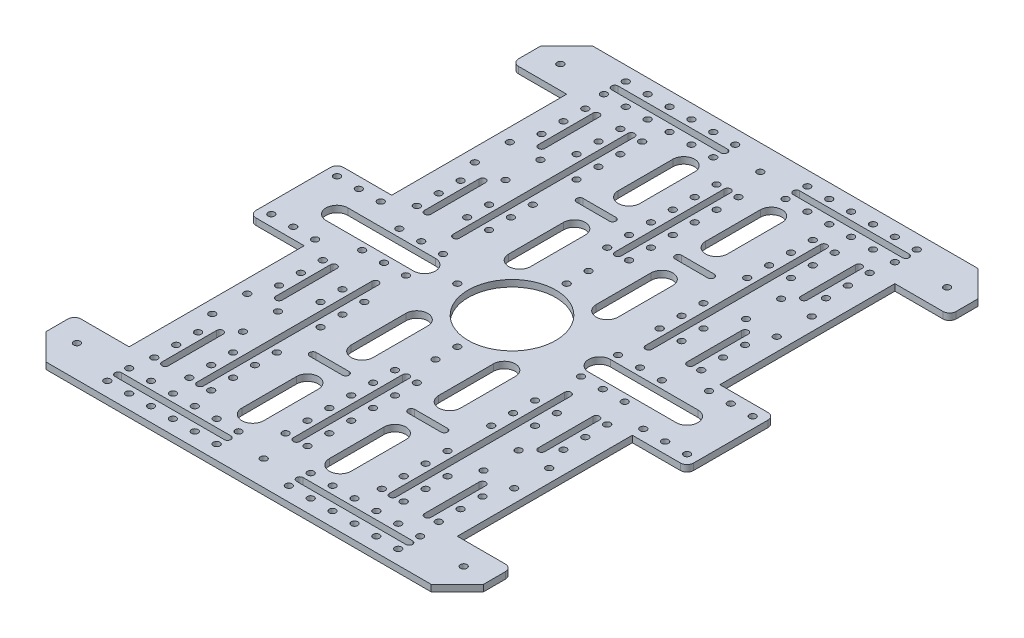
from build123d import *

# Parameters (mm, degrees)
SKETCH1_R           = 1.5
SKETCH1_R_2         = 20
BOSS_EXTRUDE1_DEPTH = 3


with BuildPart() as part:
    # Sketch1 → Boss-Extrude1 (new body)
    with BuildSketch(Plane(origin=(0, 0, 0), x_dir=(1, 0, 0), z_dir=(0, 1, 0))):
        with BuildLine():
            Line((-100, 113), (-88, 125))
            Line((-88, 125), (88, 125))
            Line((88, 125), (100, 113))
            Line((100, 113), (100, 103))
            ThreePointArc((100, 103), (99.121320344, 100.878679656), (97, 100))
            Line((97, 100), (75, 100))
            Line((75, 100), (75, 20))
            Line((75, 20), (97, 20))
            ThreePointArc((97, 20), (99.121320344, 19.121320344), (100, 17))
            Line((100, 17), (100, -17))
            ThreePointArc((100, -17), (99.121320344, -19.121320344), (97, -20))
            Line((97, -20), (75, -20))
            Line((75, -20), (75, -100))
            Line((75, -100), (97, -100))
            ThreePointArc((97, -100), (99.121320344, -100.878679656), (100, -103))
            Line((100, -103), (100, -113))
            Line((100, -113), (88, -125))
            Line((88, -125), (-88, -125))
            Line((-88, -125), (-100, -113))
            Line((-100, -113), (-100, -103))
            ThreePointArc((-100, -103), (-99.121320344, -100.878679656), (-97, -100))
            Line((-97, -100), (-75, -100))
            Line((-75, -100), (-75, -20))
            Line((-75, -20), (-97, -20))
            ThreePointArc((-97, -20), (-99.121320344, -19.121320344), (-100, -17))
            Line((-100, -17), (-100, 17))
            ThreePointArc((-100, 17), (-99.121320344, 19.121320344), (-97, 20))
            Line((-97, 20), (-75, 20))
            Line((-75, 20), (-75, 100))
            Line((-75, 100), (-97, 100))
            ThreePointArc((-97, 100), (-99.121320344, 100.878679656), (-100, 103))
            Line((-100, 103), (-100, 113))
        make_face()
        with Locations(Location((0, 113.5, 0), (0, 0, 270))):
            Circle(SKETCH1_R, mode=Mode.SUBTRACT)
        with Locations(Location((0, 0, 0), (0, 0, 270))):
            Circle(SKETCH1_R_2, mode=Mode.SUBTRACT)
        with Locations(Location((-69, 68, 0), (0, 0, 270))):
            Circle(SKETCH1_R, mode=Mode.SUBTRACT)
        with Locations(Location((-69, 52, 0), (0, 0, 270))):
            Circle(SKETCH1_R, mode=Mode.SUBTRACT)
        with Locations(Location((-55, 68, 0), (0, 0, 270))):
            Circle(SKETCH1_R, mode=Mode.SUBTRACT)
        with Locations(Location((-55, 52, 0), (0, 0, 270))):
            Circle(SKETCH1_R, mode=Mode.SUBTRACT)
        with Locations(Location((-88.381273056, 110.47659132, 0), (0, 0, 270))):
            Circle(SKETCH1_R, mode=Mode.SUBTRACT)
        with Locations(Location((-49, 98.5, 0), (0, 0, 270))):
            Circle(SKETCH1_R, mode=Mode.SUBTRACT)
        with Locations(Location((-49, 88.5, 0), (0, 0, 270))):
            Circle(SKETCH1_R, mode=Mode.SUBTRACT)
        with Locations(Location((-49, 78.5, 0), (0, 0, 270))):
            Circle(SKETCH1_R, mode=Mode.SUBTRACT)
        with Locations(Location((-49, 38.5, 0), (0, 0, 270))):
            Circle(SKETCH1_R, mode=Mode.SUBTRACT)
        with Locations(Location((-49, 28.5, 0), (0, 0, 270))):
            Circle(SKETCH1_R, mode=Mode.SUBTRACT)
        with Locations(Location((-39, 88.5, 0), (0, 0, 270))):
            Circle(SKETCH1_R, mode=Mode.SUBTRACT)
        with Locations(Location((-39, 78.5, 0), (0, 0, 270))):
            Circle(SKETCH1_R, mode=Mode.SUBTRACT)
        with Locations(Location((-39, 68.5, 0), (0, 0, 270))):
            Circle(SKETCH1_R, mode=Mode.SUBTRACT)
        with Locations(Location((-39, 48.5, 0), (0, 0, 270))):
            Circle(SKETCH1_R, mode=Mode.SUBTRACT)
        with Locations(Location((-39, 38.5, 0), (0, 0, 270))):
            Circle(SKETCH1_R, mode=Mode.SUBTRACT)
        with Locations(Location((-39, 28.5, 0), (0, 0, 270))):
            Circle(SKETCH1_R, mode=Mode.SUBTRACT)
        with Locations(Location((-39, 98.5, 0), (0, 0, 270))):
            Circle(SKETCH1_R, mode=Mode.SUBTRACT)
        with Locations(Location((-66.5, 108.5, 0), (0, 0, 270))):
            Circle(SKETCH1_R, mode=Mode.SUBTRACT)
        with Locations(Location((-56.5, 108.5, 0), (0, 0, 270))):
            Circle(SKETCH1_R, mode=Mode.SUBTRACT)
        with Locations(Location((-46.5, 108.5, 0), (0, 0, 270))):
            Circle(SKETCH1_R, mode=Mode.SUBTRACT)
        with Locations(Location((-36.5, 108.5, 0), (0, 0, 270))):
            Circle(SKETCH1_R, mode=Mode.SUBTRACT)
        with Locations(Location((-26.5, 108.5, 0), (0, 0, 270))):
            Circle(SKETCH1_R, mode=Mode.SUBTRACT)
        with Locations(Location((-16.5, 108.5, 0), (0, 0, 270))):
            Circle(SKETCH1_R, mode=Mode.SUBTRACT)
        with Locations(Location((-56.5, 118.5, 0), (0, 0, 270))):
            Circle(SKETCH1_R, mode=Mode.SUBTRACT)
        with Locations(Location((-46.5, 118.5, 0), (0, 0, 270))):
            Circle(SKETCH1_R, mode=Mode.SUBTRACT)
        with Locations(Location((-36.5, 118.5, 0), (0, 0, 270))):
            Circle(SKETCH1_R, mode=Mode.SUBTRACT)
        with Locations(Location((-26.5, 118.5, 0), (0, 0, 270))):
            Circle(SKETCH1_R, mode=Mode.SUBTRACT)
        with Locations(Location((-16.5, 118.5, 0), (0, 0, 270))):
            Circle(SKETCH1_R, mode=Mode.SUBTRACT)
        with Locations(Location((-66.5, 118.5, 0), (0, 0, 270))):
            Circle(SKETCH1_R, mode=Mode.SUBTRACT)
        with Locations(Location((-5, 98.5, 0), (0, 0, 270))):
            Circle(SKETCH1_R, mode=Mode.SUBTRACT)
        with Locations(Location((-5, 88.5, 0), (0, 0, 270))):
            Circle(SKETCH1_R, mode=Mode.SUBTRACT)
        with Locations(Location((-5, 78.5, 0), (0, 0, 270))):
            Circle(SKETCH1_R, mode=Mode.SUBTRACT)
        with Locations(Location((-5, 68.5, 0), (0, 0, 270))):
            Circle(SKETCH1_R, mode=Mode.SUBTRACT)
        with Locations(Location((-5, 58.5, 0), (0, 0, 270))):
            Circle(SKETCH1_R, mode=Mode.SUBTRACT)
        with Locations(Location((-5, 48.5, 0), (0, 0, 270))):
            Circle(SKETCH1_R, mode=Mode.SUBTRACT)
        with Locations(Location((-95, 15, 0), (0, 0, 270))):
            Circle(SKETCH1_R, mode=Mode.SUBTRACT)
        with Locations(Location((-85, 15, 0), (0, 0, 270))):
            Circle(SKETCH1_R, mode=Mode.SUBTRACT)
        with Locations(Location((-75, 15, 0), (0, 0, 270))):
            Circle(SKETCH1_R, mode=Mode.SUBTRACT)
        with Locations(Location((-65, 98.5, 0), (0, 0, 270))):
            Circle(SKETCH1_R, mode=Mode.SUBTRACT)
        with Locations(Location((-65, 88.5, 0), (0, 0, 270))):
            Circle(SKETCH1_R, mode=Mode.SUBTRACT)
        with Locations(Location((-65, 78.5, 0), (0, 0, 270))):
            Circle(SKETCH1_R, mode=Mode.SUBTRACT)
        with Locations(Location((-65, 21.5, 0), (0, 0, 270))):
            Circle(SKETCH1_R, mode=Mode.SUBTRACT)
        with Locations(Location((-65, 31.5, 0), (0, 0, 270))):
            Circle(SKETCH1_R, mode=Mode.SUBTRACT)
        with Locations(Location((-65, 41.5, 0), (0, 0, 270))):
            Circle(SKETCH1_R, mode=Mode.SUBTRACT)
        with Locations(Location((-60, 8.5, 0), (0, 0, 270))):
            Circle(SKETCH1_R, mode=Mode.SUBTRACT)
        with Locations(Location((-50, 8.5, 0), (0, 0, 270))):
            Circle(SKETCH1_R, mode=Mode.SUBTRACT)
        with Locations(Location((-40, 8.5, 0), (0, 0, 270))):
            Circle(SKETCH1_R, mode=Mode.SUBTRACT)
        with Locations(Location((-40, -8.5, 0), (0, 0, 270))):
            Circle(SKETCH1_R, mode=Mode.SUBTRACT)
        with Locations(Location((-50, -8.5, 0), (0, 0, 270))):
            Circle(SKETCH1_R, mode=Mode.SUBTRACT)
        with Locations(Location((-60, -8.5, 0), (0, 0, 270))):
            Circle(SKETCH1_R, mode=Mode.SUBTRACT)
        with Locations(Location((-65, -41.5, 0), (0, 0, 270))):
            Circle(SKETCH1_R, mode=Mode.SUBTRACT)
        with Locations(Location((-65, -31.5, 0), (0, 0, 270))):
            Circle(SKETCH1_R, mode=Mode.SUBTRACT)
        with Locations(Location((-65, -21.5, 0), (0, 0, 270))):
            Circle(SKETCH1_R, mode=Mode.SUBTRACT)
        with Locations(Location((-65, -78.5, 0), (0, 0, 270))):
            Circle(SKETCH1_R, mode=Mode.SUBTRACT)
        with Locations(Location((-65, -88.5, 0), (0, 0, 270))):
            Circle(SKETCH1_R, mode=Mode.SUBTRACT)
        with Locations(Location((-65, -98.5, 0), (0, 0, 270))):
            Circle(SKETCH1_R, mode=Mode.SUBTRACT)
        with Locations(Location((-75, -15, 0), (0, 0, 270))):
            Circle(SKETCH1_R, mode=Mode.SUBTRACT)
        with Locations(Location((-85, -15, 0), (0, 0, 270))):
            Circle(SKETCH1_R, mode=Mode.SUBTRACT)
        with Locations(Location((-95, -15, 0), (0, 0, 270))):
            Circle(SKETCH1_R, mode=Mode.SUBTRACT)
        with Locations(Location((-5, -48.5, 0), (0, 0, 270))):
            Circle(SKETCH1_R, mode=Mode.SUBTRACT)
        with Locations(Location((-5, -58.5, 0), (0, 0, 270))):
            Circle(SKETCH1_R, mode=Mode.SUBTRACT)
        with Locations(Location((-5, -68.5, 0), (0, 0, 270))):
            Circle(SKETCH1_R, mode=Mode.SUBTRACT)
        with Locations(Location((-5, -78.5, 0), (0, 0, 270))):
            Circle(SKETCH1_R, mode=Mode.SUBTRACT)
        with Locations(Location((-5, -88.5, 0), (0, 0, 270))):
            Circle(SKETCH1_R, mode=Mode.SUBTRACT)
        with Locations(Location((-5, -98.5, 0), (0, 0, 270))):
            Circle(SKETCH1_R, mode=Mode.SUBTRACT)
        with Locations(Location((-66.5, -118.5, 0), (0, 0, 270))):
            Circle(SKETCH1_R, mode=Mode.SUBTRACT)
        with Locations(Location((-16.5, -118.5, 0), (0, 0, 270))):
            Circle(SKETCH1_R, mode=Mode.SUBTRACT)
        with Locations(Location((-26.5, -118.5, 0), (0, 0, 270))):
            Circle(SKETCH1_R, mode=Mode.SUBTRACT)
        with Locations(Location((-36.5, -118.5, 0), (0, 0, 270))):
            Circle(SKETCH1_R, mode=Mode.SUBTRACT)
        with Locations(Location((-46.5, -118.5, 0), (0, 0, 270))):
            Circle(SKETCH1_R, mode=Mode.SUBTRACT)
        with Locations(Location((-56.5, -118.5, 0), (0, 0, 270))):
            Circle(SKETCH1_R, mode=Mode.SUBTRACT)
        with Locations(Location((-16.5, -108.5, 0), (0, 0, 270))):
            Circle(SKETCH1_R, mode=Mode.SUBTRACT)
        with Locations(Location((-26.5, -108.5, 0), (0, 0, 270))):
            Circle(SKETCH1_R, mode=Mode.SUBTRACT)
        with Locations(Location((-36.5, -108.5, 0), (0, 0, 270))):
            Circle(SKETCH1_R, mode=Mode.SUBTRACT)
        with Locations(Location((-46.5, -108.5, 0), (0, 0, 270))):
            Circle(SKETCH1_R, mode=Mode.SUBTRACT)
        with Locations(Location((-56.5, -108.5, 0), (0, 0, 270))):
            Circle(SKETCH1_R, mode=Mode.SUBTRACT)
        with Locations(Location((-66.5, -108.5, 0), (0, 0, 270))):
            Circle(SKETCH1_R, mode=Mode.SUBTRACT)
        with Locations(Location((-39, -98.5, 0), (0, 0, 270))):
            Circle(SKETCH1_R, mode=Mode.SUBTRACT)
        with Locations(Location((-39, -28.5, 0), (0, 0, 270))):
            Circle(SKETCH1_R, mode=Mode.SUBTRACT)
        with Locations(Location((-39, -38.5, 0), (0, 0, 270))):
            Circle(SKETCH1_R, mode=Mode.SUBTRACT)
        with Locations(Location((-39, -48.5, 0), (0, 0, 270))):
            Circle(SKETCH1_R, mode=Mode.SUBTRACT)
        with Locations(Location((-39, -68.5, 0), (0, 0, 270))):
            Circle(SKETCH1_R, mode=Mode.SUBTRACT)
        with Locations(Location((-39, -78.5, 0), (0, 0, 270))):
            Circle(SKETCH1_R, mode=Mode.SUBTRACT)
        with Locations(Location((-39, -88.5, 0), (0, 0, 270))):
            Circle(SKETCH1_R, mode=Mode.SUBTRACT)
        with Locations(Location((-49, -28.5, 0), (0, 0, 270))):
            Circle(SKETCH1_R, mode=Mode.SUBTRACT)
        with Locations(Location((-49, -38.5, 0), (0, 0, 270))):
            Circle(SKETCH1_R, mode=Mode.SUBTRACT)
        with Locations(Location((-49, -78.5, 0), (0, 0, 270))):
            Circle(SKETCH1_R, mode=Mode.SUBTRACT)
        with Locations(Location((-49, -88.5, 0), (0, 0, 270))):
            Circle(SKETCH1_R, mode=Mode.SUBTRACT)
        with Locations(Location((-49, -98.5, 0), (0, 0, 270))):
            Circle(SKETCH1_R, mode=Mode.SUBTRACT)
        with Locations(Location((-88.381273056, -110.47659132, 0), (0, 0, 270))):
            Circle(SKETCH1_R, mode=Mode.SUBTRACT)
        with Locations(Location((-55, -52, 0), (0, 0, 270))):
            Circle(SKETCH1_R, mode=Mode.SUBTRACT)
        with Locations(Location((-55, -68, 0), (0, 0, 270))):
            Circle(SKETCH1_R, mode=Mode.SUBTRACT)
        with Locations(Location((-69, -52, 0), (0, 0, 270))):
            Circle(SKETCH1_R, mode=Mode.SUBTRACT)
        with Locations(Location((-69, -68, 0), (0, 0, 270))):
            Circle(SKETCH1_R, mode=Mode.SUBTRACT)
        with Locations(Location((0, -113.5, 0), (0, 0, 270))):
            Circle(SKETCH1_R, mode=Mode.SUBTRACT)
        with Locations(Location((69, -68, 0), (0, 0, 270))):
            Circle(SKETCH1_R, mode=Mode.SUBTRACT)
        with Locations(Location((69, -52, 0), (0, 0, 270))):
            Circle(SKETCH1_R, mode=Mode.SUBTRACT)
        with Locations(Location((55, -68, 0), (0, 0, 270))):
            Circle(SKETCH1_R, mode=Mode.SUBTRACT)
        with Locations(Location((55, -52, 0), (0, 0, 270))):
            Circle(SKETCH1_R, mode=Mode.SUBTRACT)
        with Locations(Location((88.381273056, -110.47659132, 0), (0, 0, 270))):
            Circle(SKETCH1_R, mode=Mode.SUBTRACT)
        with Locations(Location((49, -98.5, 0), (0, 0, 270))):
            Circle(SKETCH1_R, mode=Mode.SUBTRACT)
        with Locations(Location((49, -88.5, 0), (0, 0, 270))):
            Circle(SKETCH1_R, mode=Mode.SUBTRACT)
        with Locations(Location((49, -78.5, 0), (0, 0, 270))):
            Circle(SKETCH1_R, mode=Mode.SUBTRACT)
        with Locations(Location((49, -38.5, 0), (0, 0, 270))):
            Circle(SKETCH1_R, mode=Mode.SUBTRACT)
        with Locations(Location((49, -28.5, 0), (0, 0, 270))):
            Circle(SKETCH1_R, mode=Mode.SUBTRACT)
        with Locations(Location((39, -88.5, 0), (0, 0, 270))):
            Circle(SKETCH1_R, mode=Mode.SUBTRACT)
        with Locations(Location((39, -78.5, 0), (0, 0, 270))):
            Circle(SKETCH1_R, mode=Mode.SUBTRACT)
        with Locations(Location((39, -68.5, 0), (0, 0, 270))):
            Circle(SKETCH1_R, mode=Mode.SUBTRACT)
        with Locations(Location((39, -48.5, 0), (0, 0, 270))):
            Circle(SKETCH1_R, mode=Mode.SUBTRACT)
        with Locations(Location((39, -38.5, 0), (0, 0, 270))):
            Circle(SKETCH1_R, mode=Mode.SUBTRACT)
        with Locations(Location((39, -28.5, 0), (0, 0, 270))):
            Circle(SKETCH1_R, mode=Mode.SUBTRACT)
        with Locations(Location((39, -98.5, 0), (0, 0, 270))):
            Circle(SKETCH1_R, mode=Mode.SUBTRACT)
        with Locations(Location((66.5, -108.5, 0), (0, 0, 270))):
            Circle(SKETCH1_R, mode=Mode.SUBTRACT)
        with Locations(Location((56.5, -108.5, 0), (0, 0, 270))):
            Circle(SKETCH1_R, mode=Mode.SUBTRACT)
        with Locations(Location((46.5, -108.5, 0), (0, 0, 270))):
            Circle(SKETCH1_R, mode=Mode.SUBTRACT)
        with Locations(Location((36.5, -108.5, 0), (0, 0, 270))):
            Circle(SKETCH1_R, mode=Mode.SUBTRACT)
        with Locations(Location((26.5, -108.5, 0), (0, 0, 270))):
            Circle(SKETCH1_R, mode=Mode.SUBTRACT)
        with Locations(Location((16.5, -108.5, 0), (0, 0, 270))):
            Circle(SKETCH1_R, mode=Mode.SUBTRACT)
        with Locations(Location((56.5, -118.5, 0), (0, 0, 270))):
            Circle(SKETCH1_R, mode=Mode.SUBTRACT)
        with Locations(Location((46.5, -118.5, 0), (0, 0, 270))):
            Circle(SKETCH1_R, mode=Mode.SUBTRACT)
        with Locations(Location((36.5, -118.5, 0), (0, 0, 270))):
            Circle(SKETCH1_R, mode=Mode.SUBTRACT)
        with Locations(Location((26.5, -118.5, 0), (0, 0, 270))):
            Circle(SKETCH1_R, mode=Mode.SUBTRACT)
        with Locations(Location((16.5, -118.5, 0), (0, 0, 270))):
            Circle(SKETCH1_R, mode=Mode.SUBTRACT)
        with Locations(Location((66.5, -118.5, 0), (0, 0, 270))):
            Circle(SKETCH1_R, mode=Mode.SUBTRACT)
        with Locations(Location((5, -98.5, 0), (0, 0, 270))):
            Circle(SKETCH1_R, mode=Mode.SUBTRACT)
        with Locations(Location((5, -88.5, 0), (0, 0, 270))):
            Circle(SKETCH1_R, mode=Mode.SUBTRACT)
        with Locations(Location((5, -78.5, 0), (0, 0, 270))):
            Circle(SKETCH1_R, mode=Mode.SUBTRACT)
        with Locations(Location((5, -68.5, 0), (0, 0, 270))):
            Circle(SKETCH1_R, mode=Mode.SUBTRACT)
        with Locations(Location((5, -58.5, 0), (0, 0, 270))):
            Circle(SKETCH1_R, mode=Mode.SUBTRACT)
        with Locations(Location((5, -48.5, 0), (0, 0, 270))):
            Circle(SKETCH1_R, mode=Mode.SUBTRACT)
        with Locations(Location((95, -15, 0), (0, 0, 270))):
            Circle(SKETCH1_R, mode=Mode.SUBTRACT)
        with Locations(Location((85, -15, 0), (0, 0, 270))):
            Circle(SKETCH1_R, mode=Mode.SUBTRACT)
        with Locations(Location((75, -15, 0), (0, 0, 270))):
            Circle(SKETCH1_R, mode=Mode.SUBTRACT)
        with Locations(Location((65, -98.5, 0), (0, 0, 270))):
            Circle(SKETCH1_R, mode=Mode.SUBTRACT)
        with Locations(Location((65, -88.5, 0), (0, 0, 270))):
            Circle(SKETCH1_R, mode=Mode.SUBTRACT)
        with Locations(Location((65, -78.5, 0), (0, 0, 270))):
            Circle(SKETCH1_R, mode=Mode.SUBTRACT)
        with Locations(Location((65, -21.5, 0), (0, 0, 270))):
            Circle(SKETCH1_R, mode=Mode.SUBTRACT)
        with Locations(Location((65, -31.5, 0), (0, 0, 270))):
            Circle(SKETCH1_R, mode=Mode.SUBTRACT)
        with Locations(Location((65, -41.5, 0), (0, 0, 270))):
            Circle(SKETCH1_R, mode=Mode.SUBTRACT)
        with Locations(Location((60, -8.5, 0), (0, 0, 270))):
            Circle(SKETCH1_R, mode=Mode.SUBTRACT)
        with Locations(Location((50, -8.5, 0), (0, 0, 270))):
            Circle(SKETCH1_R, mode=Mode.SUBTRACT)
        with Locations(Location((40, -8.5, 0), (0, 0, 270))):
            Circle(SKETCH1_R, mode=Mode.SUBTRACT)
        with Locations(Location((40, 8.5, 0), (0, 0, 270))):
            Circle(SKETCH1_R, mode=Mode.SUBTRACT)
        with Locations(Location((50, 8.5, 0), (0, 0, 270))):
            Circle(SKETCH1_R, mode=Mode.SUBTRACT)
        with Locations(Location((60, 8.5, 0), (0, 0, 270))):
            Circle(SKETCH1_R, mode=Mode.SUBTRACT)
        with Locations(Location((65, 41.5, 0), (0, 0, 270))):
            Circle(SKETCH1_R, mode=Mode.SUBTRACT)
        with Locations(Location((65, 31.5, 0), (0, 0, 270))):
            Circle(SKETCH1_R, mode=Mode.SUBTRACT)
        with Locations(Location((65, 21.5, 0), (0, 0, 270))):
            Circle(SKETCH1_R, mode=Mode.SUBTRACT)
        with Locations(Location((65, 78.5, 0), (0, 0, 270))):
            Circle(SKETCH1_R, mode=Mode.SUBTRACT)
        with Locations(Location((65, 88.5, 0), (0, 0, 270))):
            Circle(SKETCH1_R, mode=Mode.SUBTRACT)
        with Locations(Location((65, 98.5, 0), (0, 0, 270))):
            Circle(SKETCH1_R, mode=Mode.SUBTRACT)
        with Locations(Location((75, 15, 0), (0, 0, 270))):
            Circle(SKETCH1_R, mode=Mode.SUBTRACT)
        with Locations(Location((85, 15, 0), (0, 0, 270))):
            Circle(SKETCH1_R, mode=Mode.SUBTRACT)
        with Locations(Location((95, 15, 0), (0, 0, 270))):
            Circle(SKETCH1_R, mode=Mode.SUBTRACT)
        with Locations(Location((5, 48.5, 0), (0, 0, 270))):
            Circle(SKETCH1_R, mode=Mode.SUBTRACT)
        with Locations(Location((5, 58.5, 0), (0, 0, 270))):
            Circle(SKETCH1_R, mode=Mode.SUBTRACT)
        with Locations(Location((5, 68.5, 0), (0, 0, 270))):
            Circle(SKETCH1_R, mode=Mode.SUBTRACT)
        with Locations(Location((5, 78.5, 0), (0, 0, 270))):
            Circle(SKETCH1_R, mode=Mode.SUBTRACT)
        with Locations(Location((5, 88.5, 0), (0, 0, 270))):
            Circle(SKETCH1_R, mode=Mode.SUBTRACT)
        with Locations(Location((5, 98.5, 0), (0, 0, 270))):
            Circle(SKETCH1_R, mode=Mode.SUBTRACT)
        with Locations(Location((66.5, 118.5, 0), (0, 0, 270))):
            Circle(SKETCH1_R, mode=Mode.SUBTRACT)
        with Locations(Location((16.5, 118.5, 0), (0, 0, 270))):
            Circle(SKETCH1_R, mode=Mode.SUBTRACT)
        with Locations(Location((26.5, 118.5, 0), (0, 0, 270))):
            Circle(SKETCH1_R, mode=Mode.SUBTRACT)
        with Locations(Location((36.5, 118.5, 0), (0, 0, 270))):
            Circle(SKETCH1_R, mode=Mode.SUBTRACT)
        with Locations(Location((46.5, 118.5, 0), (0, 0, 270))):
            Circle(SKETCH1_R, mode=Mode.SUBTRACT)
        with Locations(Location((56.5, 118.5, 0), (0, 0, 270))):
            Circle(SKETCH1_R, mode=Mode.SUBTRACT)
        with Locations(Location((16.5, 108.5, 0), (0, 0, 270))):
            Circle(SKETCH1_R, mode=Mode.SUBTRACT)
        with Locations(Location((26.5, 108.5, 0), (0, 0, 270))):
            Circle(SKETCH1_R, mode=Mode.SUBTRACT)
        with Locations(Location((36.5, 108.5, 0), (0, 0, 270))):
            Circle(SKETCH1_R, mode=Mode.SUBTRACT)
        with Locations(Location((46.5, 108.5, 0), (0, 0, 270))):
            Circle(SKETCH1_R, mode=Mode.SUBTRACT)
        with Locations(Location((56.5, 108.5, 0), (0, 0, 270))):
            Circle(SKETCH1_R, mode=Mode.SUBTRACT)
        with Locations(Location((66.5, 108.5, 0), (0, 0, 270))):
            Circle(SKETCH1_R, mode=Mode.SUBTRACT)
        with Locations(Location((39, 98.5, 0), (0, 0, 270))):
            Circle(SKETCH1_R, mode=Mode.SUBTRACT)
        with Locations(Location((39, 28.5, 0), (0, 0, 270))):
            Circle(SKETCH1_R, mode=Mode.SUBTRACT)
        with Locations(Location((39, 38.5, 0), (0, 0, 270))):
            Circle(SKETCH1_R, mode=Mode.SUBTRACT)
        with Locations(Location((39, 48.5, 0), (0, 0, 270))):
            Circle(SKETCH1_R, mode=Mode.SUBTRACT)
        with Locations(Location((39, 68.5, 0), (0, 0, 270))):
            Circle(SKETCH1_R, mode=Mode.SUBTRACT)
        with Locations(Location((39, 78.5, 0), (0, 0, 270))):
            Circle(SKETCH1_R, mode=Mode.SUBTRACT)
        with Locations(Location((39, 88.5, 0), (0, 0, 270))):
            Circle(SKETCH1_R, mode=Mode.SUBTRACT)
        with Locations(Location((49, 28.5, 0), (0, 0, 270))):
            Circle(SKETCH1_R, mode=Mode.SUBTRACT)
        with Locations(Location((49, 38.5, 0), (0, 0, 270))):
            Circle(SKETCH1_R, mode=Mode.SUBTRACT)
        with Locations(Location((49, 78.5, 0), (0, 0, 270))):
            Circle(SKETCH1_R, mode=Mode.SUBTRACT)
        with Locations(Location((49, 88.5, 0), (0, 0, 270))):
            Circle(SKETCH1_R, mode=Mode.SUBTRACT)
        with Locations(Location((49, 98.5, 0), (0, 0, 270))):
            Circle(SKETCH1_R, mode=Mode.SUBTRACT)
        with Locations(Location((88.381273056, 110.47659132, 0), (0, 0, 270))):
            Circle(SKETCH1_R, mode=Mode.SUBTRACT)
        with Locations(Location((55, 52, 0), (0, 0, 270))):
            Circle(SKETCH1_R, mode=Mode.SUBTRACT)
        with Locations(Location((55, 68, 0), (0, 0, 270))):
            Circle(SKETCH1_R, mode=Mode.SUBTRACT)
        with Locations(Location((69, 52, 0), (0, 0, 270))):
            Circle(SKETCH1_R, mode=Mode.SUBTRACT)
        with Locations(Location((69, 68, 0), (0, 0, 270))):
            Circle(SKETCH1_R, mode=Mode.SUBTRACT)
        with Locations(Location((0, 25, 0), (0, 0, 270))):
            Circle(SKETCH1_R, mode=Mode.SUBTRACT)
        with Locations(Location((0, 35, 0), (0, 0, 270))):
            Circle(SKETCH1_R, mode=Mode.SUBTRACT)
        with Locations(Location((0, -35, 0), (0, 0, 270))):
            Circle(SKETCH1_R, mode=Mode.SUBTRACT)
        with Locations(Location((0, -25, 0), (0, 0, 270))):
            Circle(SKETCH1_R, mode=Mode.SUBTRACT)
        with Locations(Location((-25, 0, 0), (0, 0, 270))):
            Circle(SKETCH1_R, mode=Mode.SUBTRACT)
        with BuildLine():
            Line((-66.5, 115), (-16.5, 115))
            ThreePointArc((-16.5, 115), (-15, 113.5), (-16.5, 112))
            Line((-16.5, 112), (-66.5, 112))
            ThreePointArc((-66.5, 112), (-68, 113.5), (-66.5, 115))
        make_face(mode=Mode.SUBTRACT)
        with BuildLine():
            Line((1.5, 98.5), (1.5, 48.5))
            ThreePointArc((1.5, 48.5), (0, 47), (-1.5, 48.5))
            Line((-1.5, 48.5), (-1.5, 98.5))
            ThreePointArc((-1.5, 98.5), (0, 100), (1.5, 98.5))
        make_face(mode=Mode.SUBTRACT)
        with BuildLine():
            Line((-42.5, 98.5), (-42.5, 18.5))
            ThreePointArc((-42.5, 18.5), (-44, 17), (-45.5, 18.5))
            Line((-45.5, 18.5), (-45.5, 98.5))
            ThreePointArc((-45.5, 98.5), (-44, 100), (-42.5, 98.5))
        make_face(mode=Mode.SUBTRACT)
        with BuildLine():
            Line((-15, 98.5), (-15, 73.5))
            ThreePointArc((-15, 73.5), (-20, 68.5), (-25, 73.5))
            Line((-25, 73.5), (-25, 98.5))
            ThreePointArc((-25, 98.5), (-20, 103.5), (-15, 98.5))
        make_face(mode=Mode.SUBTRACT)
        with BuildLine():
            Line((-15, 48.5), (-15, 23.5))
            ThreePointArc((-15, 23.5), (-20, 18.5), (-25, 23.5))
            Line((-25, 23.5), (-25, 48.5))
            ThreePointArc((-25, 48.5), (-20, 53.5), (-15, 48.5))
        make_face(mode=Mode.SUBTRACT)
        with BuildLine():
            Line((-80, 5), (-40, 5))
            ThreePointArc((-40, 5), (-35, 0), (-40, -5))
            Line((-40, -5), (-80, -5))
            ThreePointArc((-80, -5), (-85, 0), (-80, 5))
        make_face(mode=Mode.SUBTRACT)
        with BuildLine():
            Line((-30, 62.5), (-15, 62.5))
            ThreePointArc((-15, 62.5), (-13.5, 61), (-15, 59.5))
            Line((-15, 59.5), (-30, 59.5))
            ThreePointArc((-30, 59.5), (-31.5, 61), (-30, 62.5))
        make_face(mode=Mode.SUBTRACT)
        with BuildLine():
            Line((-58.5, 98.5), (-58.5, 73.5))
            ThreePointArc((-58.5, 73.5), (-60, 72), (-61.5, 73.5))
            Line((-61.5, 73.5), (-61.5, 98.5))
            ThreePointArc((-61.5, 98.5), (-60, 100), (-58.5, 98.5))
        make_face(mode=Mode.SUBTRACT)
        with BuildLine():
            Line((-58.5, 21.5), (-58.5, 46.5))
            ThreePointArc((-58.5, 46.5), (-60, 48), (-61.5, 46.5))
            Line((-61.5, 46.5), (-61.5, 21.5))
            ThreePointArc((-61.5, 21.5), (-60, 20), (-58.5, 21.5))
        make_face(mode=Mode.SUBTRACT)
        with BuildLine():
            Line((-58.5, -21.5), (-58.5, -46.5))
            ThreePointArc((-58.5, -46.5), (-60, -48), (-61.5, -46.5))
            Line((-61.5, -46.5), (-61.5, -21.5))
            ThreePointArc((-61.5, -21.5), (-60, -20), (-58.5, -21.5))
        make_face(mode=Mode.SUBTRACT)
        with BuildLine():
            Line((-58.5, -98.5), (-58.5, -73.5))
            ThreePointArc((-58.5, -73.5), (-60, -72), (-61.5, -73.5))
            Line((-61.5, -73.5), (-61.5, -98.5))
            ThreePointArc((-61.5, -98.5), (-60, -100), (-58.5, -98.5))
        make_face(mode=Mode.SUBTRACT)
        with BuildLine():
            Line((-30, -62.5), (-15, -62.5))
            ThreePointArc((-15, -62.5), (-13.5, -61), (-15, -59.5))
            Line((-15, -59.5), (-30, -59.5))
            ThreePointArc((-30, -59.5), (-31.5, -61), (-30, -62.5))
        make_face(mode=Mode.SUBTRACT)
        with BuildLine():
            Line((-15, -48.5), (-15, -23.5))
            ThreePointArc((-15, -23.5), (-20, -18.5), (-25, -23.5))
            Line((-25, -23.5), (-25, -48.5))
            ThreePointArc((-25, -48.5), (-20, -53.5), (-15, -48.5))
        make_face(mode=Mode.SUBTRACT)
        with BuildLine():
            Line((-15, -98.5), (-15, -73.5))
            ThreePointArc((-15, -73.5), (-20, -68.5), (-25, -73.5))
            Line((-25, -73.5), (-25, -98.5))
            ThreePointArc((-25, -98.5), (-20, -103.5), (-15, -98.5))
        make_face(mode=Mode.SUBTRACT)
        with BuildLine():
            Line((-42.5, -98.5), (-42.5, -18.5))
            ThreePointArc((-42.5, -18.5), (-44, -17), (-45.5, -18.5))
            Line((-45.5, -18.5), (-45.5, -98.5))
            ThreePointArc((-45.5, -98.5), (-44, -100), (-42.5, -98.5))
        make_face(mode=Mode.SUBTRACT)
        with BuildLine():
            Line((1.5, -98.5), (1.5, -48.5))
            ThreePointArc((1.5, -48.5), (0, -47), (-1.5, -48.5))
            Line((-1.5, -48.5), (-1.5, -98.5))
            ThreePointArc((-1.5, -98.5), (0, -100), (1.5, -98.5))
        make_face(mode=Mode.SUBTRACT)
        with BuildLine():
            Line((-66.5, -115), (-16.5, -115))
            ThreePointArc((-16.5, -115), (-15, -113.5), (-16.5, -112))
            Line((-16.5, -112), (-66.5, -112))
            ThreePointArc((-66.5, -112), (-68, -113.5), (-66.5, -115))
        make_face(mode=Mode.SUBTRACT)
        with BuildLine():
            Line((66.5, -115), (16.5, -115))
            ThreePointArc((16.5, -115), (15, -113.5), (16.5, -112))
            Line((16.5, -112), (66.5, -112))
            ThreePointArc((66.5, -112), (68, -113.5), (66.5, -115))
        make_face(mode=Mode.SUBTRACT)
        with BuildLine():
            Line((42.5, -98.5), (42.5, -18.5))
            ThreePointArc((42.5, -18.5), (44, -17), (45.5, -18.5))
            Line((45.5, -18.5), (45.5, -98.5))
            ThreePointArc((45.5, -98.5), (44, -100), (42.5, -98.5))
        make_face(mode=Mode.SUBTRACT)
        with BuildLine():
            Line((15, -98.5), (15, -73.5))
            ThreePointArc((15, -73.5), (20, -68.5), (25, -73.5))
            Line((25, -73.5), (25, -98.5))
            ThreePointArc((25, -98.5), (20, -103.5), (15, -98.5))
        make_face(mode=Mode.SUBTRACT)
        with BuildLine():
            Line((15, -48.5), (15, -23.5))
            ThreePointArc((15, -23.5), (20, -18.5), (25, -23.5))
            Line((25, -23.5), (25, -48.5))
            ThreePointArc((25, -48.5), (20, -53.5), (15, -48.5))
        make_face(mode=Mode.SUBTRACT)
        with BuildLine():
            Line((30, -62.5), (15, -62.5))
            ThreePointArc((15, -62.5), (13.5, -61), (15, -59.5))
            Line((15, -59.5), (30, -59.5))
            ThreePointArc((30, -59.5), (31.5, -61), (30, -62.5))
        make_face(mode=Mode.SUBTRACT)
        with BuildLine():
            Line((58.5, -98.5), (58.5, -73.5))
            ThreePointArc((58.5, -73.5), (60, -72), (61.5, -73.5))
            Line((61.5, -73.5), (61.5, -98.5))
            ThreePointArc((61.5, -98.5), (60, -100), (58.5, -98.5))
        make_face(mode=Mode.SUBTRACT)
        with BuildLine():
            Line((58.5, -21.5), (58.5, -46.5))
            ThreePointArc((58.5, -46.5), (60, -48), (61.5, -46.5))
            Line((61.5, -46.5), (61.5, -21.5))
            ThreePointArc((61.5, -21.5), (60, -20), (58.5, -21.5))
        make_face(mode=Mode.SUBTRACT)
        with BuildLine():
            Line((58.5, 21.5), (58.5, 46.5))
            ThreePointArc((58.5, 46.5), (60, 48), (61.5, 46.5))
            Line((61.5, 46.5), (61.5, 21.5))
            ThreePointArc((61.5, 21.5), (60, 20), (58.5, 21.5))
        make_face(mode=Mode.SUBTRACT)
        with BuildLine():
            Line((58.5, 98.5), (58.5, 73.5))
            ThreePointArc((58.5, 73.5), (60, 72), (61.5, 73.5))
            Line((61.5, 73.5), (61.5, 98.5))
            ThreePointArc((61.5, 98.5), (60, 100), (58.5, 98.5))
        make_face(mode=Mode.SUBTRACT)
        with BuildLine():
            Line((30, 62.5), (15, 62.5))
            ThreePointArc((15, 62.5), (13.5, 61), (15, 59.5))
            Line((15, 59.5), (30, 59.5))
            ThreePointArc((30, 59.5), (31.5, 61), (30, 62.5))
        make_face(mode=Mode.SUBTRACT)
        with BuildLine():
            Line((80, 5), (40, 5))
            ThreePointArc((40, 5), (35, 0), (40, -5))
            Line((40, -5), (80, -5))
            ThreePointArc((80, -5), (85, 0), (80, 5))
        make_face(mode=Mode.SUBTRACT)
        with BuildLine():
            Line((15, 48.5), (15, 23.5))
            ThreePointArc((15, 23.5), (20, 18.5), (25, 23.5))
            Line((25, 23.5), (25, 48.5))
            ThreePointArc((25, 48.5), (20, 53.5), (15, 48.5))
        make_face(mode=Mode.SUBTRACT)
        with BuildLine():
            Line((15, 98.5), (15, 73.5))
            ThreePointArc((15, 73.5), (20, 68.5), (25, 73.5))
            Line((25, 73.5), (25, 98.5))
            ThreePointArc((25, 98.5), (20, 103.5), (15, 98.5))
        make_face(mode=Mode.SUBTRACT)
        with BuildLine():
            Line((42.5, 98.5), (42.5, 18.5))
            ThreePointArc((42.5, 18.5), (44, 17), (45.5, 18.5))
            Line((45.5, 18.5), (45.5, 98.5))
            ThreePointArc((45.5, 98.5), (44, 100), (42.5, 98.5))
        make_face(mode=Mode.SUBTRACT)
        with BuildLine():
            Line((66.5, 115), (16.5, 115))
            ThreePointArc((16.5, 115), (15, 113.5), (16.5, 112))
            Line((16.5, 112), (66.5, 112))
            ThreePointArc((66.5, 112), (68, 113.5), (66.5, 115))
        make_face(mode=Mode.SUBTRACT)
    extrude(amount=BOSS_EXTRUDE1_DEPTH)


solid = part.part
